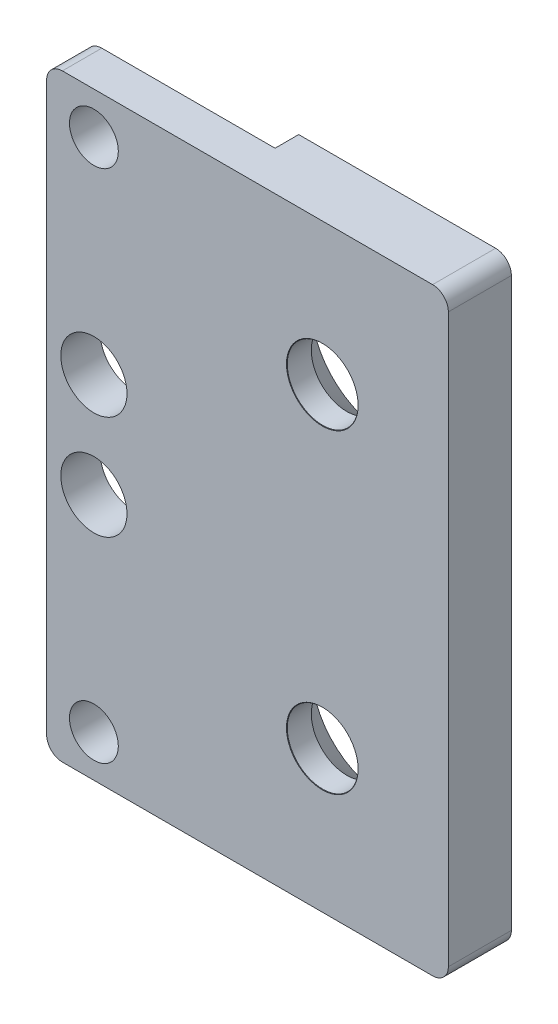
from build123d import *

# Parameters (mm, degrees)
SKETCH1_W                                    = 25.5
SKETCH1_H                                    = 38
BOSS_EXTRUDE1_DEPTH                          = 4
CUT_EXTRUDE1_REACH                           = 42.281
SKETCH2_W                                    = 12
SKETCH2_H                                    = 1.5
CSK_FOR_M4_COUNTERSUNK_FLAT_HEAD_SCR_2_COUNT = 2
CSK_FOR_M4_COUNTERSUNK_FLAT_HEAD_SCR_2_PITCH = 20
M3_CLEARANCE_HOLE1_D                         = 3.1
HOLE1_D                                      = 4.2
FILLET1_R                                    = 1


with BuildPart() as part:
    # Sketch1 → Boss-Extrude1 (new body)
    with BuildSketch(Plane.XY):
        Rectangle(SKETCH1_W, SKETCH1_H)
    extrude(amount=BOSS_EXTRUDE1_DEPTH)

    # Sketch2 → Cut-Extrude1 (cut, up to next)
    with BuildSketch(Plane(origin=(0, 19, 0), x_dir=(1, 0, 0), z_dir=(0, 1, 0)), mode=Mode.PRIVATE) as cut_extrude1_sk1:
        with Locations((-6.75, -0.75)):
            Rectangle(SKETCH2_W, SKETCH2_H)
    cut_extrude1_tool1 = extrude(cut_extrude1_sk1.sketch, amount=-CUT_EXTRUDE1_REACH, mode=Mode.PRIVATE) & part.part
    add(cut_extrude1_tool1.solids().sort_by_distance((-6.75, 19, 0.75))[0], mode=Mode.SUBTRACT)

    # Sketch5 → CSK for M4 Countersunk Flat Head Screw1 (revolve, cut)
    with BuildSketch(Plane(origin=(4.75, 10, 0), x_dir=(0, 1, 0), z_dir=(1, 0, 0))):
        Polygon((0, 0), (0, 4), (2.275, 4), (2.25, 3.975), (2.25, 2.45), (4.7, 0), align=None)
    csk_for_m4_countersunk_flat_head_screw1 = revolve(axis=Axis((4.75, 10, -6.35), (0, 0, 1)), mode=Mode.SUBTRACT)

    # CSK for M4 Countersunk Flat Head Scr 2: CSK for M4 Countersunk Flat Head Screw1 ×2
    with Locations(*[(0, -i * CSK_FOR_M4_COUNTERSUNK_FLAT_HEAD_SCR_2_PITCH, 0) for i in range(1, CSK_FOR_M4_COUNTERSUNK_FLAT_HEAD_SCR_2_COUNT)]):
        add(csk_for_m4_countersunk_flat_head_screw1, mode=Mode.SUBTRACT)

    # M3 Clearance Hole1 (through all)
    with Locations(Plane(origin=(0, 0, 1.5), x_dir=(-1, 0, 0), z_dir=(0, 0, -1))):
        with Locations((9.75, -16.35), (9.75, 16.35)):
            Hole(M3_CLEARANCE_HOLE1_D / 2)

    # Hole1 (through all)
    with Locations(Plane(origin=(0, 0, 1.5), x_dir=(-1, 0, 0), z_dir=(0, 0, -1))):
        with Locations((9.75, -3.3), (9.75, 3.3)):
            Hole(HOLE1_D / 2)

    # Fillet1
    fillet1_edges = [part.edges().sort_by_distance(p)[0] for p in [
        (-12.75, 19, 2.75),
        (12.75, 19, 2),
        (12.75, -19, 2),
        (-12.75, -19, 2.75),
    ]]
    fillet(fillet1_edges, radius=FILLET1_R)


solid = part.part
